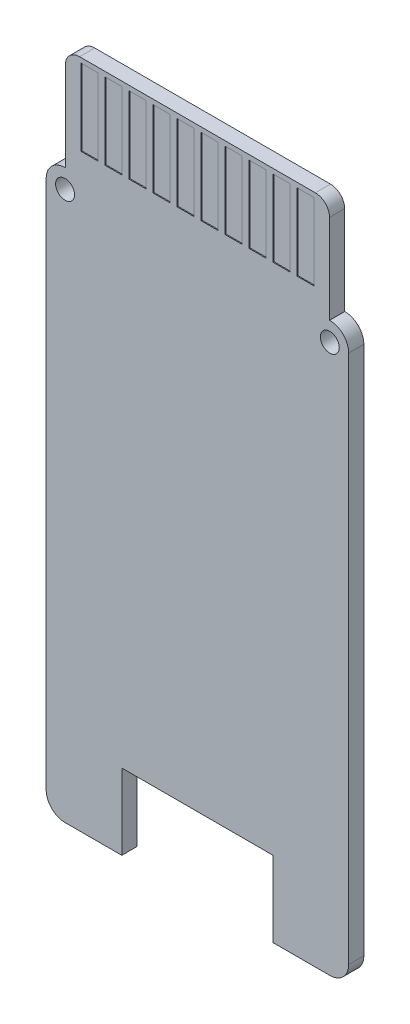
from build123d import *

# Parameters (mm, degrees)
SKETCH_1_R          = 1
EXTRUDE_1_DEPTH     = 1.6
SKETCH_2_W          = 16
SKETCH_2_H          = 8
CUT_EXTRUDE_1_DEPTH = 1.6
EXTRUDE_2_DEPTH     = 1.6
SKETCH_4_W          = 1.78
SKETCH_4_H          = 8.1
CUT_EXTRUDE_2_DEPTH = 0.1
CUT_EXTRUDE_START   = 1.6
SKETCH_5_W          = 1.78
SKETCH_5_H          = 8.1
CUT_EXTRUDE_3_DEPTH = 0.1


with BuildPart() as part:
    # 草图1 → 凸台-拉伸1 (new body)
    with BuildSketch(Plane.XY):
        with BuildLine():
            Line((-14, 30), (14, 30))
            ThreePointArc((14, 30), (15.414213562, 29.414213562), (16, 28))
            Line((16, 28), (16, -28))
            ThreePointArc((16, -28), (15.414213562, -29.414213562), (14, -30))
            Line((14, -30), (-14, -30))
            ThreePointArc((-14, -30), (-15.414213562, -29.414213562), (-16, -28))
            Line((-16, -28), (-16, 28))
            ThreePointArc((-16, 28), (-15.414213562, 29.414213562), (-14, 30))
        make_face()
        with Locations((-14, 28)):
            Circle(SKETCH_1_R, mode=Mode.SUBTRACT)
        with Locations((14, 28)):
            Circle(SKETCH_1_R, mode=Mode.SUBTRACT)
    extrude(amount=EXTRUDE_1_DEPTH)

    # 草图2 → 切除-拉伸1 (cut)
    with BuildSketch(Plane.XY):
        with Locations((0, -26)):
            Rectangle(SKETCH_2_W, SKETCH_2_H)
    extrude(amount=CUT_EXTRUDE_1_DEPTH, mode=Mode.SUBTRACT)

    # 草图3 → 凸台-拉伸2 (add)
    with BuildSketch(Plane.XY):
        with BuildLine():
            Line((-13.97, 30), (13.97, 30))
            Line((13.97, 30), (13.97, 39.42))
            ThreePointArc((13.97, 39.42), (13.530660172, 40.480660172), (12.47, 40.92))
            Line((12.47, 40.92), (-12.47, 40.92))
            ThreePointArc((-12.47, 40.92), (-13.530660172, 40.480660172), (-13.97, 39.42))
            Line((-13.97, 39.42), (-13.97, 30))
        make_face()
    extrude(amount=EXTRUDE_2_DEPTH)

    # 草图4 → 切除-拉伸2 (cut)
    with BuildSketch(Plane.XY):
        with Locations((-1.27, 36.37)):
            Rectangle(SKETCH_4_W, SKETCH_4_H)
        with Locations((-3.81, 36.37)):
            Rectangle(SKETCH_4_W, SKETCH_4_H)
        with Locations((-6.35, 36.37)):
            Rectangle(SKETCH_4_W, SKETCH_4_H)
        with Locations((-8.89, 36.37)):
            Rectangle(SKETCH_4_W, SKETCH_4_H)
        with Locations((-11.43, 36.37)):
            Rectangle(SKETCH_4_W, SKETCH_4_H)
        with Locations((11.43, 36.37)):
            Rectangle(SKETCH_4_W, SKETCH_4_H)
        with Locations((8.89, 36.37)):
            Rectangle(SKETCH_4_W, SKETCH_4_H)
        with Locations((6.35, 36.37)):
            Rectangle(SKETCH_4_W, SKETCH_4_H)
        with Locations((3.81, 36.37)):
            Rectangle(SKETCH_4_W, SKETCH_4_H)
        with Locations((1.27, 36.37)):
            Rectangle(SKETCH_4_W, SKETCH_4_H)
    extrude(amount=CUT_EXTRUDE_2_DEPTH, mode=Mode.SUBTRACT)

    # 草图5 → 切除-拉伸3 (cut)
    with BuildSketch(Plane.XY.offset(CUT_EXTRUDE_START)):
        with Locations((-3.81, 36.37)):
            Rectangle(SKETCH_5_W, SKETCH_5_H)
        with Locations((-1.27, 36.37)):
            Rectangle(SKETCH_5_W, SKETCH_5_H)
        with Locations((-11.43, 36.37)):
            Rectangle(SKETCH_5_W, SKETCH_5_H)
        with Locations((-8.89, 36.37)):
            Rectangle(SKETCH_5_W, SKETCH_5_H)
        with Locations((-6.35, 36.37)):
            Rectangle(SKETCH_5_W, SKETCH_5_H)
        with Locations((1.27, 36.37)):
            Rectangle(SKETCH_5_W, SKETCH_5_H)
        with Locations((3.81, 36.37)):
            Rectangle(SKETCH_5_W, SKETCH_5_H)
        with Locations((6.35, 36.37)):
            Rectangle(SKETCH_5_W, SKETCH_5_H)
        with Locations((8.89, 36.37)):
            Rectangle(SKETCH_5_W, SKETCH_5_H)
        with Locations((11.43, 36.37)):
            Rectangle(SKETCH_5_W, SKETCH_5_H)
    extrude(amount=-CUT_EXTRUDE_3_DEPTH, mode=Mode.SUBTRACT)


solid = part.part
